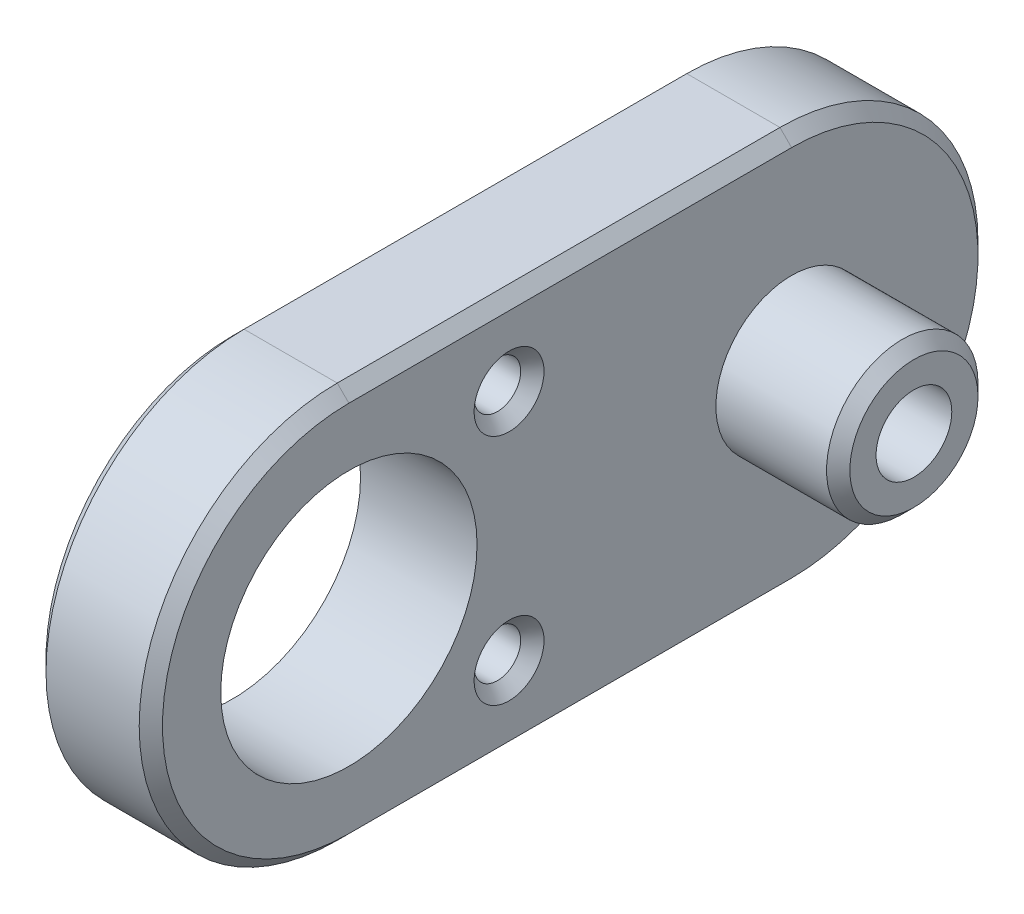
from build123d import *

# Parameters (mm, degrees)
SKETCH1_R           = 1.625
SKETCH1_R_2         = 5.5
SKETCH1_R_3         = 1
BOSS_EXTRUDE1_DEPTH = 5
SKETCH1_3_R         = 3.25
SKETCH1_3_R_2       = 1.625
BOSS_EXTRUDE2_DEPTH = 10.25
CUT_EXTRUDE1_DEPTH  = 3
CHAMFER2_SIZE       = 0.5


with BuildPart() as part:
    # Sketch1 → Boss-Extrude1 (new body)
    with BuildSketch(Plane(origin=(0, 0, 0), x_dir=(0, 0, -1), z_dir=(1, 0, 0))):
        with BuildLine():
            Line((0, -8.5), (-19, -8.5))
            ThreePointArc((-19, -8.5), (-27.5, 0), (-19, 8.5))
            Line((-19, 8.5), (0, 8.5))
            ThreePointArc((0, 8.5), (8.5, 0), (0, -8.5))
        make_face()
        Circle(SKETCH1_R, mode=Mode.SUBTRACT)
        with Locations((-19, 0)):
            Circle(SKETCH1_R_2, mode=Mode.SUBTRACT)
        with Locations((-12.126136458, -5)):
            Circle(SKETCH1_R_3, mode=Mode.SUBTRACT)
        with Locations((-12.126136458, 5)):
            Circle(SKETCH1_R_3, mode=Mode.SUBTRACT)
    extrude(amount=BOSS_EXTRUDE1_DEPTH)

    # Sketch1<3> → Boss-Extrude2 (add)
    with BuildSketch(Plane(origin=(0, 0, 0), x_dir=(0, 0, -1), z_dir=(1, 0, 0))):
        Circle(SKETCH1_3_R)
        Circle(SKETCH1_3_R_2, mode=Mode.SUBTRACT)
    extrude(amount=BOSS_EXTRUDE2_DEPTH)

    # Sketch2 → Cut-Extrude1 (cut)
    with BuildSketch(Plane.ZY):
        Polygon((0, 3.319764048), (-2.875, 1.659882024), (-2.875, -1.659882024), (0, -3.319764048), (2.875, -1.659882024), (2.875, 1.659882024), align=None)
    extrude(amount=-CUT_EXTRUDE1_DEPTH, mode=Mode.SUBTRACT)

    # Chamfer2
    chamfer2_edges = [part.edges().sort_by_distance(p)[0] for p in [
        (0, 5, 13.126136458),
        (0, -5, 13.126136458),
        (0, 0, -8.5),
        (0, -8.5, 9.5),
        (0, 0, 27.5),
        (0, 8.5, 9.5),
        (5, 8.5, 9.5),
        (5, 0, 27.5),
        (5, -8.5, 9.5),
        (5, 0, -8.5),
        (10.25, 0, 3.25),
        (5, -5, 13.126136458),
        (5, 5, 13.126136458),
        (0, -2.489823036, -1.4375),
        (0, -2.489823036, 1.4375),
        (0, 0, 2.875),
        (0, 2.489823036, 1.4375),
        (0, 2.489823036, -1.4375),
        (0, 0, -2.875),
    ]]
    chamfer(chamfer2_edges, length=CHAMFER2_SIZE)


solid = part.part
